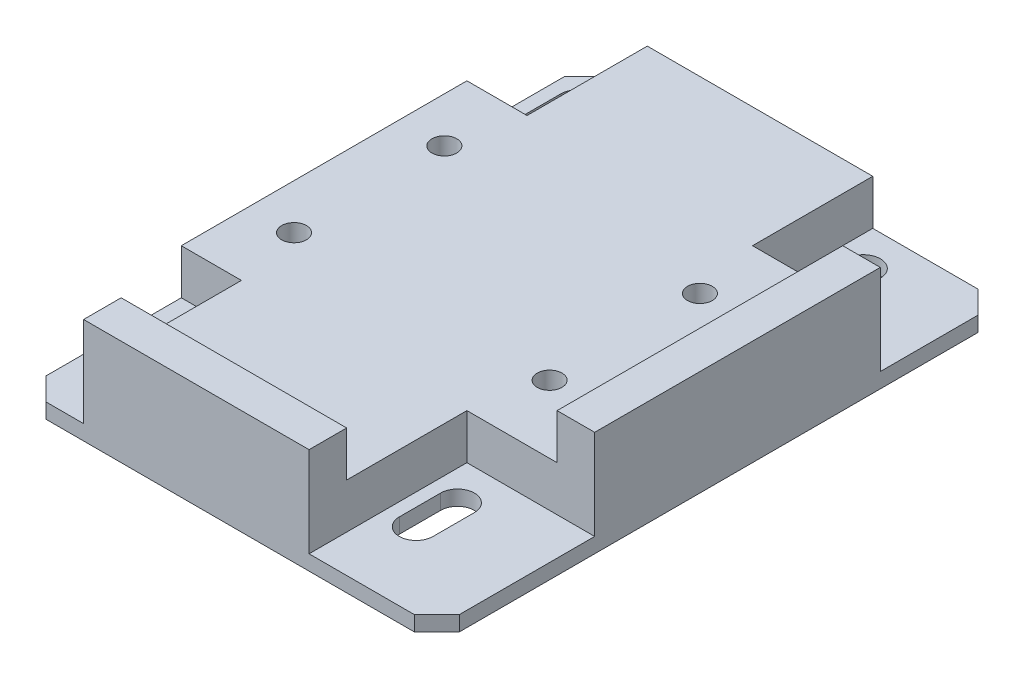
from build123d import *

# Parameters (mm, degrees)
SKETCH_1_W                  = 55
SKETCH_1_H                  = 75
EXTRUDE_1_DEPTH             = 14
SKETCH_2_W                  = 50
SKETCH_2_H                  = 70
CUT_EXTRUDE_1_DEPTH         = 6
SKETCH_3_W                  = 17
SKETCH_3_H                  = 21
SKETCH_3_H_2                = 16
SKETCH_3_W_2                = 8
CUT_EXTRUDE_2_DEPTH         = 12
CUT_EXTRUDE_3_REACH         = 50.026
PATTERN_LINEAR_1_COUNT      = 2
PATTERN_LINEAR_1_PITCH      = 34
PATTERN_LINEAR_1_COUNT_DIR2 = 2
PATTERN_LINEAR_1_PITCH_DIR2 = 20
CHAMFER_1_SIZE              = 3


with BuildPart() as part:
    # 草图1 → 凸台-拉伸1 (new body)
    with BuildSketch(Plane(origin=(0, 0, 0), x_dir=(1, 0, 0), z_dir=(0, 1, 0))):
        Rectangle(SKETCH_1_W, SKETCH_1_H)
    extrude(amount=EXTRUDE_1_DEPTH)

    # 草图2 → 切除-拉伸1 (cut)
    with BuildSketch(Plane(origin=(0, 14, 0), x_dir=(1, 0, 0), z_dir=(0, 1, 0))):
        with Locations((-2.5, 2.5)):
            Rectangle(SKETCH_2_W, SKETCH_2_H)
    extrude(amount=-CUT_EXTRUDE_1_DEPTH, mode=Mode.SUBTRACT)

    # 草图3 → 切除-拉伸2 (cut)
    with BuildSketch(Plane(origin=(0, 14, 0), x_dir=(1, 0, 0), z_dir=(0, 1, 0))):
        with Locations((19, -27)):
            Rectangle(SKETCH_3_W, SKETCH_3_H)
        with Locations((19, 29.5)):
            Rectangle(SKETCH_3_W, SKETCH_3_H_2)
        with Locations((-23.5, 29.5)):
            Rectangle(SKETCH_3_W_2, SKETCH_3_H_2)
        with Locations((-23.5, -27)):
            Rectangle(SKETCH_3_W_2, SKETCH_3_H)
    extrude(amount=-CUT_EXTRUDE_2_DEPTH, mode=Mode.SUBTRACT)

    # 草图4 → 切除-拉伸3 (cut, up to next)
    with BuildSketch(Plane(origin=(0, 2, 0), x_dir=(1, 0, 0), z_dir=(0, 1, 0)), mode=Mode.PRIVATE) as cut_extrude_3_sk1:
        with BuildLine():
            Line((-21.25, 32.25), (-21.25, 26.75))
            ThreePointArc((-21.25, 26.75), (-23.5, 24.5), (-25.75, 26.75))
            Line((-25.75, 26.75), (-25.75, 32.25))
            ThreePointArc((-25.75, 32.25), (-23.5, 34.5), (-21.25, 32.25))
        make_face()
    cut_extrude_3_tool1 = extrude(cut_extrude_3_sk1.sketch, amount=-CUT_EXTRUDE_3_REACH, mode=Mode.PRIVATE) & part.part
    # 草图4 → 切除-拉伸3 (cut, up to next)
    with BuildSketch(Plane(origin=(0, 2, 0), x_dir=(1, 0, 0), z_dir=(0, 1, 0)), mode=Mode.PRIVATE) as cut_extrude_3_sk2:
        with BuildLine():
            Line((16.75, 32.25), (16.75, 26.75))
            ThreePointArc((16.75, 26.75), (14.5, 24.5), (12.25, 26.75))
            Line((12.25, 26.75), (12.25, 32.25))
            ThreePointArc((12.25, 32.25), (14.5, 34.5), (16.75, 32.25))
        make_face()
    cut_extrude_3_tool2 = extrude(cut_extrude_3_sk2.sketch, amount=-CUT_EXTRUDE_3_REACH, mode=Mode.PRIVATE) & part.part
    # 草图4 → 切除-拉伸3 (cut, up to next)
    with BuildSketch(Plane(origin=(0, 2, 0), x_dir=(1, 0, 0), z_dir=(0, 1, 0)), mode=Mode.PRIVATE) as cut_extrude_3_sk3:
        with BuildLine():
            Line((16.75, -21.75), (16.75, -27.25))
            ThreePointArc((16.75, -27.25), (14.5, -29.5), (12.25, -27.25))
            Line((12.25, -27.25), (12.25, -21.75))
            ThreePointArc((12.25, -21.75), (14.5, -19.5), (16.75, -21.75))
        make_face()
    cut_extrude_3_tool3 = extrude(cut_extrude_3_sk3.sketch, amount=-CUT_EXTRUDE_3_REACH, mode=Mode.PRIVATE) & part.part
    # 草图4 → 切除-拉伸3 (cut, up to next)
    with BuildSketch(Plane(origin=(0, 2, 0), x_dir=(1, 0, 0), z_dir=(0, 1, 0)), mode=Mode.PRIVATE) as cut_extrude_3_sk4:
        with BuildLine():
            Line((-21.25, -21.75), (-21.25, -27.25))
            ThreePointArc((-21.25, -27.25), (-23.5, -29.5), (-25.75, -27.25))
            Line((-25.75, -27.25), (-25.75, -21.75))
            ThreePointArc((-25.75, -21.75), (-23.5, -19.5), (-21.25, -21.75))
        make_face()
    cut_extrude_3_tool4 = extrude(cut_extrude_3_sk4.sketch, amount=-CUT_EXTRUDE_3_REACH, mode=Mode.PRIVATE) & part.part
    add(cut_extrude_3_tool1.solids().sort_by_distance((-23.5, 2, -29.5))[0], mode=Mode.SUBTRACT)
    add(cut_extrude_3_tool2.solids().sort_by_distance((14.5, 2, -29.5))[0], mode=Mode.SUBTRACT)
    add(cut_extrude_3_tool3.solids().sort_by_distance((14.5, 2, 24.5))[0], mode=Mode.SUBTRACT)
    add(cut_extrude_3_tool4.solids().sort_by_distance((-23.5, 2, 24.5))[0], mode=Mode.SUBTRACT)

    # 草图7 → M4 螺纹孔1 (revolve, cut)
    with BuildSketch(Plane(origin=(-21.5, 8, -12.5), x_dir=(0, 0, 1), z_dir=(1, 0, 0))):
        Polygon((0, 0), (0, 11.091420021), (1.65, 10.1), (1.65, 0), align=None)
    hole_wizard_m4_1 = revolve(axis=Axis((-21.5, 14.35, -12.5), (0, -1, 0)), mode=Mode.SUBTRACT)

    # 阵列(线性)1: Hole Wizard M4 _1 2 × 2
    with Locations(*[(i * PATTERN_LINEAR_1_PITCH, 0, j * PATTERN_LINEAR_1_PITCH_DIR2) for i in range(PATTERN_LINEAR_1_COUNT) for j in range(PATTERN_LINEAR_1_COUNT_DIR2) if (i, j) != (0, 0)]):
        add(hole_wizard_m4_1, mode=Mode.SUBTRACT)

    # 倒角1
    chamfer_1_edges = [part.edges().sort_by_distance(p)[0] for p in [
        (27.5, 1, -37.5),
        (-27.5, 1, -37.5),
        (27.5, 1, 37.5),
        (-27.5, 1, 37.5),
    ]]
    chamfer(chamfer_1_edges, length=CHAMFER_1_SIZE)


solid = part.part
